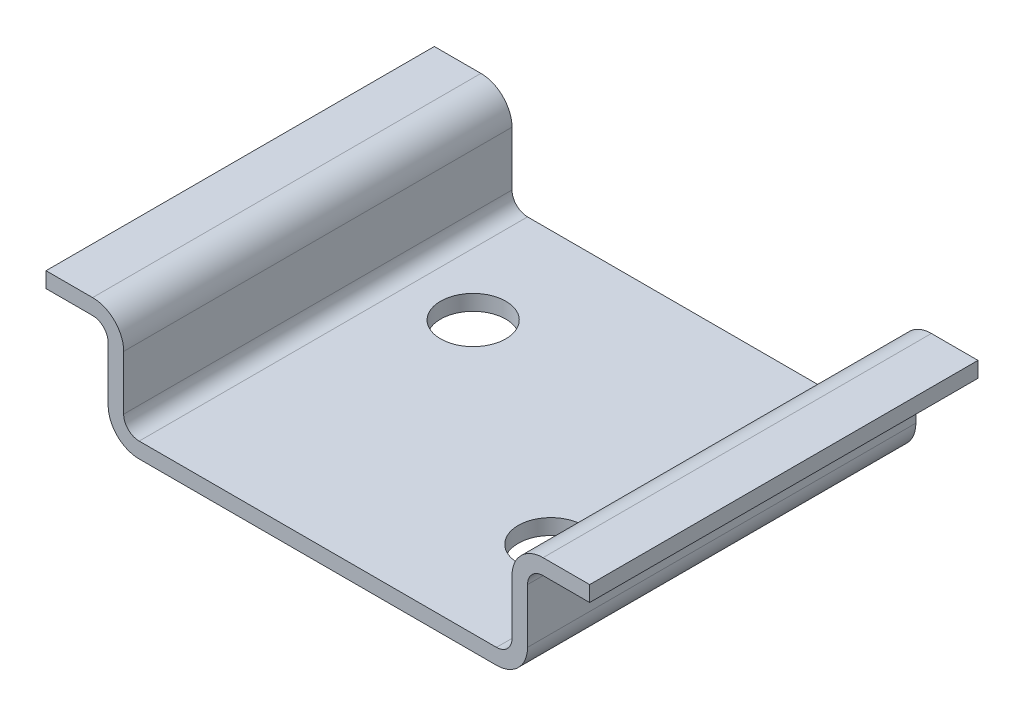
from build123d import *

# Parameters (mm, degrees)
EXTRUDE_1_DEPTH     = 90
CUT_EXTRUDE_START   = -65
CUT_EXTRUDE_2_DEPTH = 65
SKETCH_4_R          = 2.1
CUT_EXTRUDE_3_DEPTH = 10


with BuildPart() as part:
    # Эскиз1 → Вытянуть1 (new body)
    with BuildSketch(Plane.XY):
        with BuildLine():
            Line((-17.5, 6.5), (-14.5, 6.5))
            ThreePointArc((-14.5, 6.5), (-13.792893219, 6.207106781), (-13.5, 5.5))
            Line((-13.5, 5.5), (-13.5, 2))
            ThreePointArc((-13.5, 2), (-12.914213562, 0.585786438), (-11.5, 0))
            Line((-11.5, 0), (11.5, 0))
            ThreePointArc((11.5, 0), (12.914213562, 0.585786438), (13.5, 2))
            Line((13.5, 2), (13.5, 5.5))
            ThreePointArc((13.5, 5.5), (13.792893219, 6.207106781), (14.5, 6.5))
            Line((14.5, 6.5), (17.5, 6.5))
            Line((17.5, 6.5), (17.5, 7.5))
            Line((17.5, 7.5), (14.5, 7.5))
            ThreePointArc((14.5, 7.5), (13.085786438, 6.914213562), (12.5, 5.5))
            Line((12.5, 5.5), (12.5, 2))
            ThreePointArc((12.5, 2), (12.207106781, 1.292893219), (11.5, 1))
            Line((11.5, 1), (-11.5, 1))
            ThreePointArc((-11.5, 1), (-12.207106781, 1.292893219), (-12.5, 2))
            Line((-12.5, 2), (-12.5, 5.5))
            ThreePointArc((-12.5, 5.5), (-13.085786438, 6.914213562), (-14.5, 7.5))
            Line((-14.5, 7.5), (-17.5, 7.5))
            Line((-17.5, 7.5), (-17.5, 6.5))
        make_face()
    extrude(amount=EXTRUDE_1_DEPTH)

    # Эскиз3 → Вырез-Вытянуть2 (cut)
    with BuildSketch(Plane.XY.offset(90).offset(CUT_EXTRUDE_START)):
        with BuildLine():
            Line((-17.5, 7.5), (-17.5, 6.5))
            Line((-17.5, 6.5), (-14.5, 6.5))
            ThreePointArc((-14.5, 6.5), (-13.792893219, 6.207106781), (-13.5, 5.5))
            Line((-13.5, 5.5), (-13.5, 2))
            ThreePointArc((-13.5, 2), (-12.914213562, 0.585786438), (-11.5, 0))
            Line((-11.5, 0), (11.5, 0))
            ThreePointArc((11.5, 0), (12.914213562, 0.585786438), (13.5, 2))
            Line((13.5, 2), (13.5, 5.5))
            ThreePointArc((13.5, 5.5), (13.792893219, 6.207106781), (14.5, 6.5))
            Line((14.5, 6.5), (17.5, 6.5))
            Line((17.5, 6.5), (17.5, 7.5))
            Line((17.5, 7.5), (14.5, 7.5))
            ThreePointArc((14.5, 7.5), (13.085786438, 6.914213562), (12.5, 5.5))
            Line((12.5, 5.5), (12.5, 2))
            ThreePointArc((12.5, 2), (12.207106781, 1.292893219), (11.5, 1))
            Line((11.5, 1), (-11.5, 1))
            ThreePointArc((-11.5, 1), (-12.207106781, 1.292893219), (-12.5, 2))
            Line((-12.5, 2), (-12.5, 5.5))
            ThreePointArc((-12.5, 5.5), (-13.085786438, 6.914213562), (-14.5, 7.5))
            Line((-14.5, 7.5), (-17.5, 7.5))
        make_face()
    extrude(amount=CUT_EXTRUDE_2_DEPTH, mode=Mode.SUBTRACT)

    # Эскиз4 → Вырез-Вытянуть3 (cut)
    with BuildSketch(Plane(origin=(0, 1, 0), x_dir=(-1, 0, 0), z_dir=(0, 1, 0))):
        with Locations((7.5, 7.5)):
            Circle(SKETCH_4_R)
        with Locations((-7.5, 17.5)):
            Circle(SKETCH_4_R)
    extrude(amount=-CUT_EXTRUDE_3_DEPTH, mode=Mode.SUBTRACT)


solid = part.part
